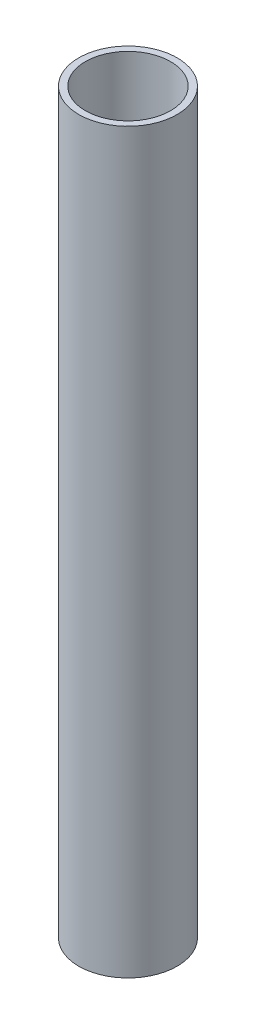
from build123d import *

# Parameters (mm, degrees)
SKETCH1_R           = 2
BOSS_EXTRUDE1_DEPTH = 30
SKETCH4_R           = 1.732548954
CUT_EXTRUDE1_DEPTH  = 30


with BuildPart() as part:
    # Sketch1 → Boss-Extrude1 (new body)
    with BuildSketch(Plane(origin=(0, 0, 0), x_dir=(1, 0, 0), z_dir=(0, 1, 0))):
        with Locations(Location((0, 0, 0), (0, 0, 270))):
            Circle(SKETCH1_R)
    extrude(amount=BOSS_EXTRUDE1_DEPTH)

    # Sketch4 → Cut-Extrude1 (cut)
    with BuildSketch(Plane(origin=(0, 30, 0), x_dir=(1, 0, 0), z_dir=(0, 1, 0))):
        with Locations(Location((0, 0, 0), (0, 0, 270))):
            Circle(SKETCH4_R)
    extrude(amount=-CUT_EXTRUDE1_DEPTH, mode=Mode.SUBTRACT)


solid = part.part
